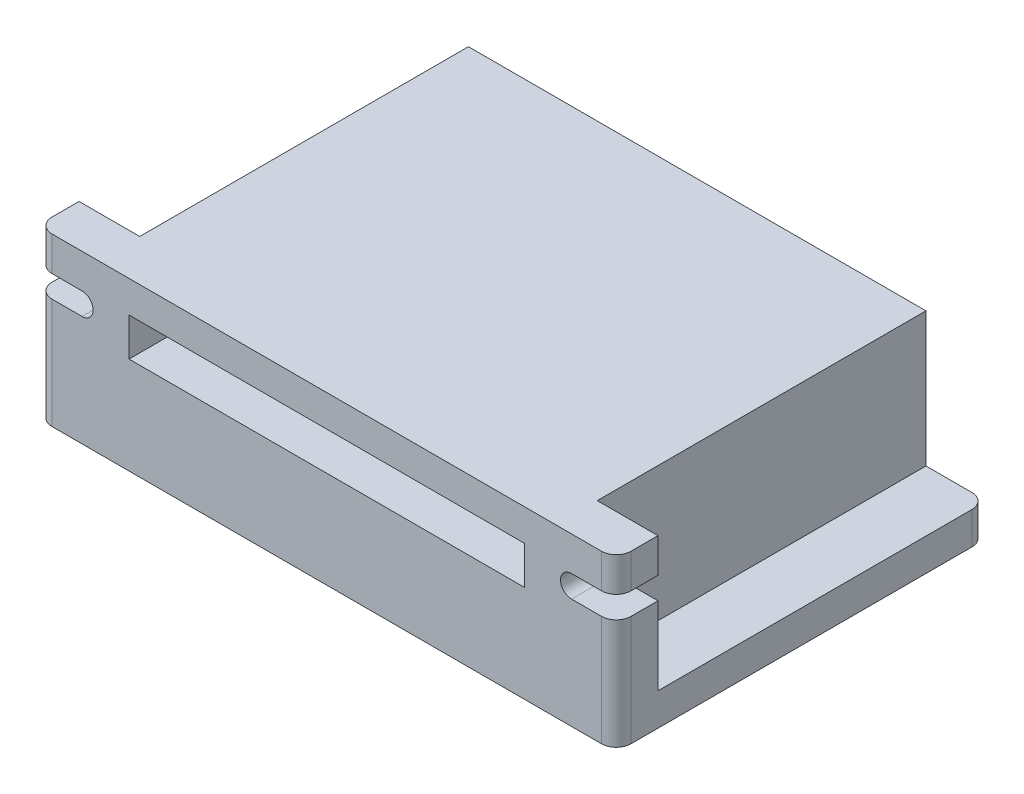
from build123d import *

# Parameters (mm, degrees)
BOSS_EXTRUDE1_DEPTH = 34
CUT_EXTRUDE1_DEPTH  = 34
SKETCH3_W           = 19.452595801
SKETCH3_H           = 34.121613058
CUT_EXTRUDE2_DEPTH  = 67
SKETCH4_W           = 80.61958461
SKETCH4_H           = 7.775745443
CUT_EXTRUDE3_DEPTH  = 10


with BuildPart() as part:
    # Sketch1 → Boss-Extrude1 (new body)
    with BuildSketch(Plane(origin=(0, 0, 0), x_dir=(1, 0, 0), z_dir=(0, 1, 0))):
        with BuildLine():
            Line((-56, -37.75), (56, -37.75))
            ThreePointArc((56, -37.75), (58.121320344, -36.871320344), (59, -34.75))
            Line((59, -34.75), (59, 34.75))
            ThreePointArc((59, 34.75), (58.121320344, 36.871320344), (56, 37.75))
            Line((56, 37.75), (-56, 37.75))
            ThreePointArc((-56, 37.75), (-58.121320344, 36.871320344), (-59, 34.75))
            Line((-59, 34.75), (-59, -34.75))
            ThreePointArc((-59, -34.75), (-58.121320344, -36.871320344), (-56, -37.75))
        make_face()
    extrude(amount=BOSS_EXTRUDE1_DEPTH)

    # Sketch2 → Cut-Extrude1 (cut)
    with BuildSketch(Plane.XY.offset(37.75)):
        with BuildLine():
            Line((-72.082720781, 27), (-49.888346505, 27))
            ThreePointArc((-49.888346505, 27), (-47.638346505, 24.75), (-49.888346505, 22.5))
            Line((-49.888346505, 22.5), (-72.082720781, 22.5))
            ThreePointArc((-72.082720781, 22.5), (-74.332720781, 24.75), (-72.082720781, 27))
        make_face()
    cut_extrude1 = extrude(amount=-CUT_EXTRUDE1_DEPTH, mode=Mode.SUBTRACT)

    # Mirror1: Cut-Extrude1 across plane
    add(cut_extrude1.mirror(Plane(origin=(0, 0, 0), x_dir=(0, 0, 1), z_dir=(1, 0, 0))), mode=Mode.SUBTRACT)

    # Sketch3 → Cut-Extrude2 (cut)
    with BuildSketch(Plane(origin=(0, 0, -37.75), x_dir=(-1, 0, 0), z_dir=(0, 0, -1))):
        with Locations((-56.356218478, 23.676559333)):
            Rectangle(SKETCH3_W, SKETCH3_H)
    cut_extrude2 = extrude(amount=-CUT_EXTRUDE2_DEPTH, mode=Mode.SUBTRACT)

    # Mirror2: Cut-Extrude2 across plane
    add(cut_extrude2.mirror(Plane(origin=(0, 0, 0), x_dir=(0, 0, 1), z_dir=(1, 0, 0))), mode=Mode.SUBTRACT)

    # Sketch4 → Cut-Extrude3 (cut)
    with BuildSketch(Plane.XY.offset(37.75)):
        with Locations((0, 23.651152712)):
            Rectangle(SKETCH4_W, SKETCH4_H)
    extrude(amount=-CUT_EXTRUDE3_DEPTH, mode=Mode.SUBTRACT)


solid = part.part
